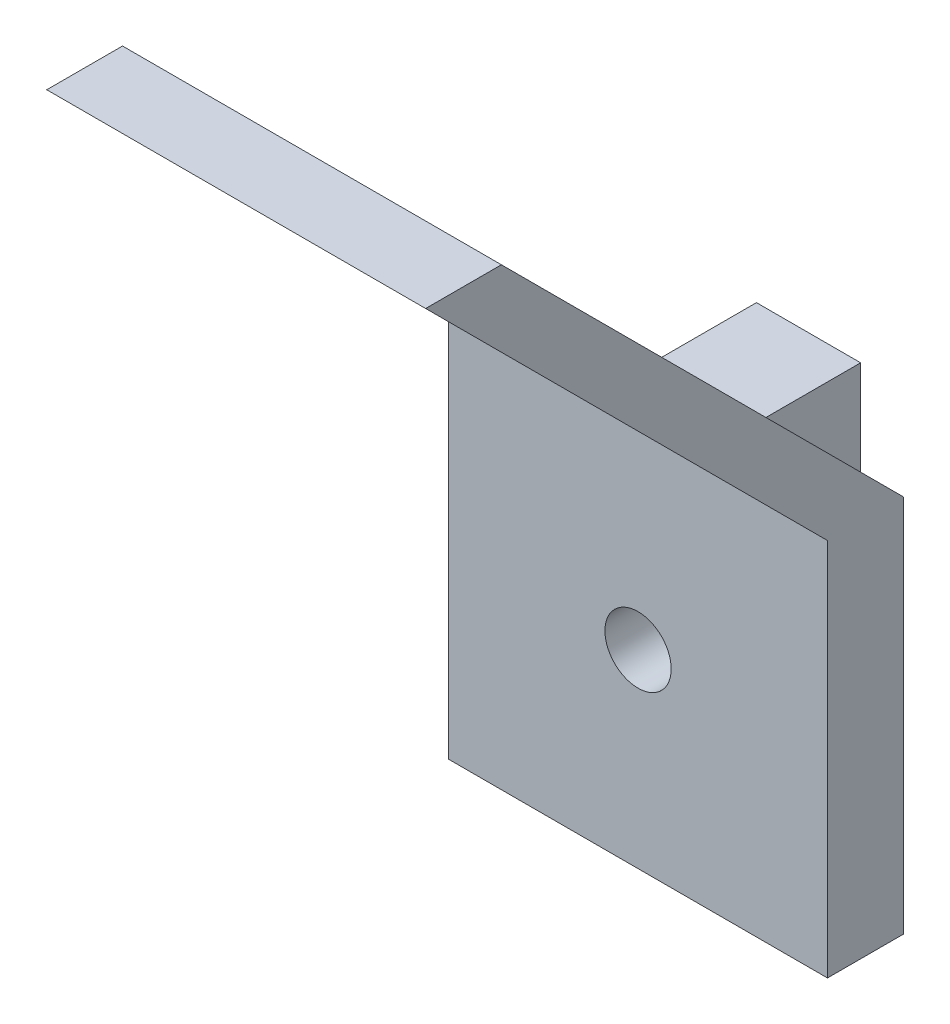
from build123d import *

# Parameters (mm, degrees)
BOSS_EXTRUDE4_DEPTH = 20
SKETCH6_R           = 1.75
CUT_EXTRUDE3_DEPTH  = 51.482948977
SKETCH7_R           = 3.3782
CUT_EXTRUDE4_DEPTH  = 52.051285634
SKETCH8_W           = 5.5
SKETCH8_H           = 5
BOSS_EXTRUDE5_DEPTH = 5


with BuildPart() as part:
    # Sketch5 → Boss-Extrude4 (new body)
    with BuildSketch(Plane(origin=(0, 0, 0), x_dir=(0, 0, -1), z_dir=(1, 0, 0))):
        Polygon((0, 0), (0, 20), (-21.213203436, 41.213203436), (-25.213203436, 41.213203436), (-4, 20), (-4, 0), align=None)
    extrude(amount=BOSS_EXTRUDE4_DEPTH)

    # Sketch6 → Cut-Extrude3 (cut, through all)
    with BuildSketch(Plane.XY.offset(4)):
        with Locations((10, 10)):
            Circle(SKETCH6_R)
    extrude(amount=-CUT_EXTRUDE3_DEPTH, mode=Mode.SUBTRACT)

    # Sketch7 → Cut-Extrude4 (cut, through all)
    with BuildSketch(Plane(origin=(0, 8, -8), x_dir=(1, 0, 0), z_dir=(0, -0.7071067811865489, 0.7071067811865462))):
        with Locations(Location((10, 31.970562748, 0), (0, 0, 270))):
            Circle(SKETCH7_R)
    extrude(amount=-CUT_EXTRUDE4_DEPTH, mode=Mode.SUBTRACT)

    # Sketch8 → Boss-Extrude5 (add)
    with BuildSketch(Plane(origin=(0, 0, 0), x_dir=(-1, 0, 0), z_dir=(0, 0, -1))):
        with Locations((-10, 17.5)):
            Rectangle(SKETCH8_W, SKETCH8_H)
        with Locations((-10, 2.5)):
            Rectangle(SKETCH8_W, SKETCH8_H)
    extrude(amount=BOSS_EXTRUDE5_DEPTH)


solid = part.part
